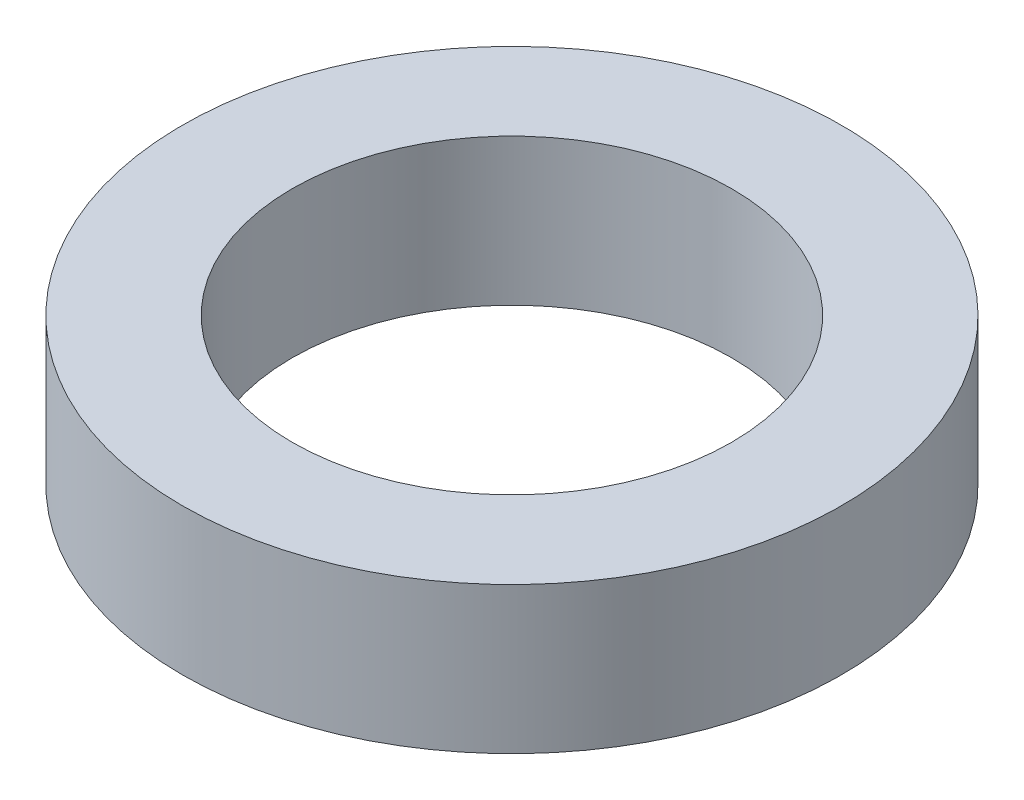
from build123d import *

# Parameters (mm, degrees)
SKETCH_1_R      = 4.5
SKETCH_1_R_2    = 3
EXTRUDE_1_DEPTH = 2


with BuildPart() as part:
    # 草图1 → 凸台-拉伸1 (new body)
    with BuildSketch(Plane(origin=(0, 0, 0), x_dir=(1, 0, 0), z_dir=(0, 1, 0))):
        with Locations(Location((0, 0, 0), (0, 0, 270))):
            Circle(SKETCH_1_R)
        with Locations(Location((0, 0, 0), (0, 0, 270))):
            Circle(SKETCH_1_R_2, mode=Mode.SUBTRACT)
    extrude(amount=EXTRUDE_1_DEPTH)


solid = part.part
